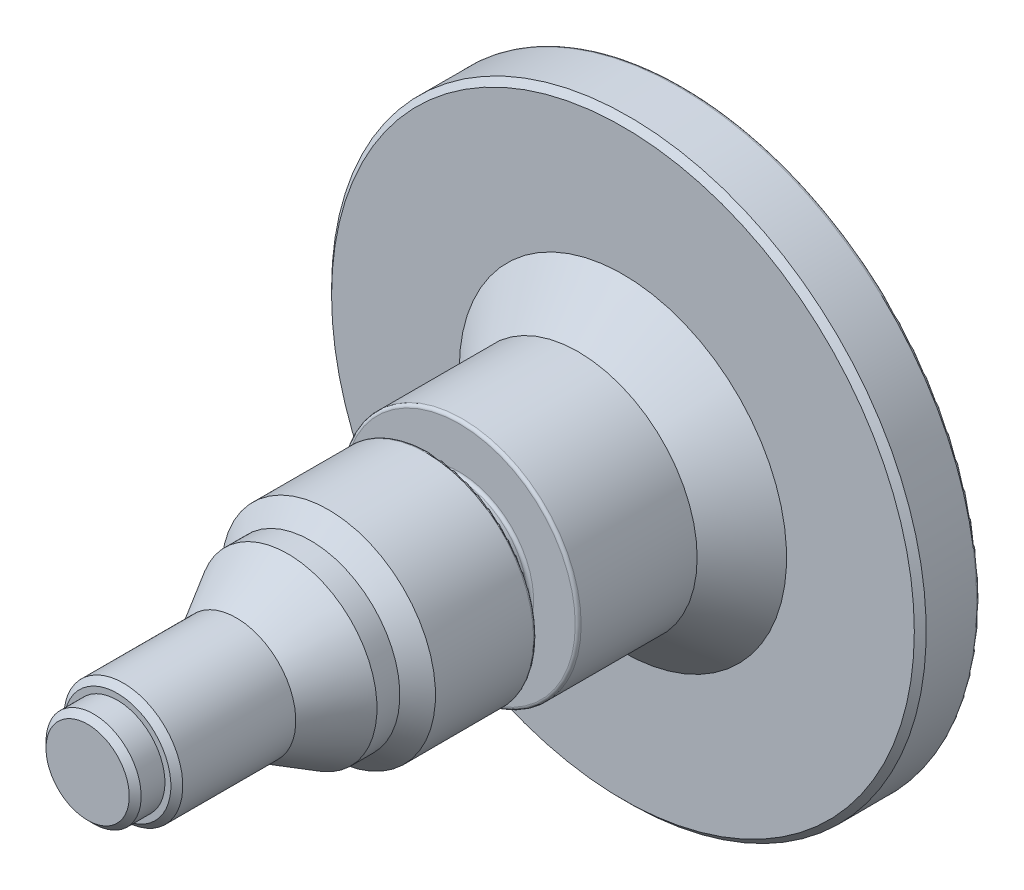
from build123d import *

# Parameters (mm, degrees)
CHAMFER1_SIZE = 1
FILLET1_R     = 0.5


with BuildPart() as part:
    # Sketch5 → Revolve1 (revolve)
    with BuildSketch(Plane(origin=(0, 0, 0), x_dir=(1, 0, 0), z_dir=(0, 1, 0)), mode=Mode.PRIVATE) as revolve1_sk:
        Polygon((0, 100.020445287), (50, 100.020445287), (49.999997016, 90.020445287), (27.520445287, 90.020445287), (20, 82.5), (20, 62.5), (12, 62.5), (12, 57.5), (18, 57.5), (18, 40.5), (15, 37.5), (15, 33.660254038), (10, 25), (10, 5), (8, 5), (8, 0), (0, 0), align=None)
    revolve(revolve1_sk.sketch.rotate(Axis((0, 0, -100.020445287), (0, 0, 1)), 180), axis=Axis((0, 0, -100.020445287), (0, 0, 1)))

    # Chamfer1
    chamfer1_edges = [part.edges().sort_by_distance(p)[0] for p in [
        (8, 0, 0),
        (10, 0, -5),
        (49.999997016, 0, -90.020445287),
    ]]
    chamfer(chamfer1_edges, length=CHAMFER1_SIZE)

    # Fillet1
    fillet1_edges = [part.edges().sort_by_distance(p)[0] for p in [
        (18, 0, -57.5),
        (12, 0, -57.5),
        (12, 0, -62.5),
        (20, 0, -62.5),
        (50, 0, -100.020445287),
    ]]
    fillet(fillet1_edges, radius=FILLET1_R)


solid = part.part
